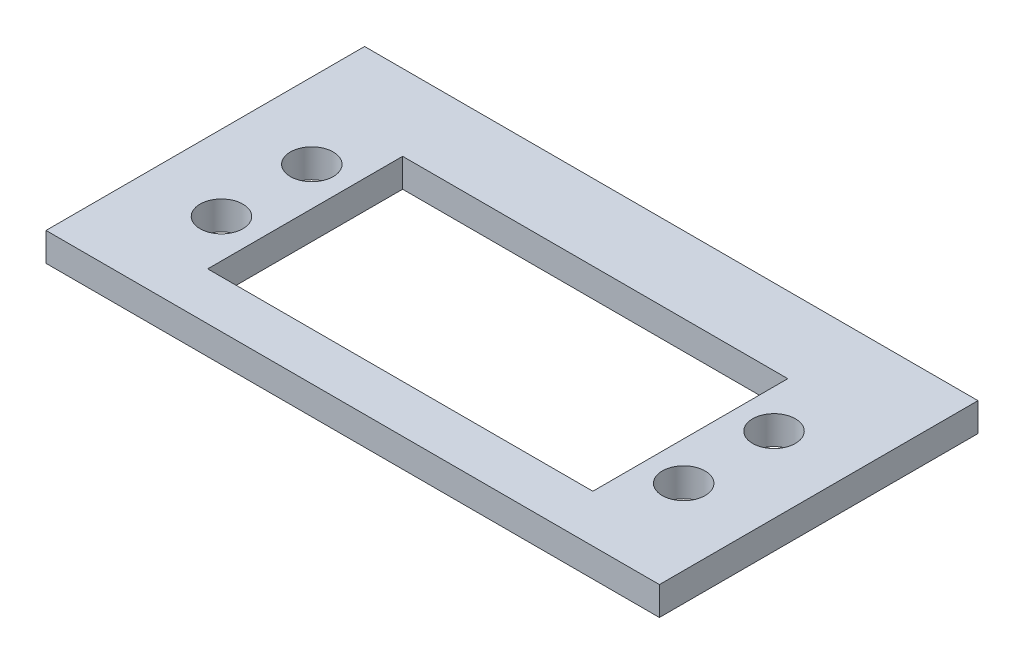
from build123d import *

# Parameters (mm, degrees)
SKETCH2_W           = 64.5
SKETCH2_H           = 33.5
SKETCH2_R           = 2.25
SKETCH2_W_2         = 40.5
SKETCH2_H_2         = 20.5
BOSS_EXTRUDE1_DEPTH = 3


with BuildPart() as part:
    # Sketch2 → Boss-Extrude1 (new body)
    with BuildSketch(Plane(origin=(0, 0, 0), x_dir=(1, 0, 0), z_dir=(0, 1, 0))):
        with Locations((32.25, 16.75)):
            Rectangle(SKETCH2_W, SKETCH2_H)
        with Locations(Location((7.95, 20, 0), (0, 0, 270))):
            Circle(SKETCH2_R, mode=Mode.SUBTRACT)
        with Locations(Location((7.95, 10.5, 0), (0, 0, 270))):
            Circle(SKETCH2_R, mode=Mode.SUBTRACT)
        with Locations(Location((56.55, 20, 0), (0, 0, 270))):
            Circle(SKETCH2_R, mode=Mode.SUBTRACT)
        with Locations(Location((56.55, 10.5, 0), (0, 0, 270))):
            Circle(SKETCH2_R, mode=Mode.SUBTRACT)
        with Locations((32.25, 15.25)):
            Rectangle(SKETCH2_W_2, SKETCH2_H_2, mode=Mode.SUBTRACT)
    extrude(amount=BOSS_EXTRUDE1_DEPTH)


solid = part.part
